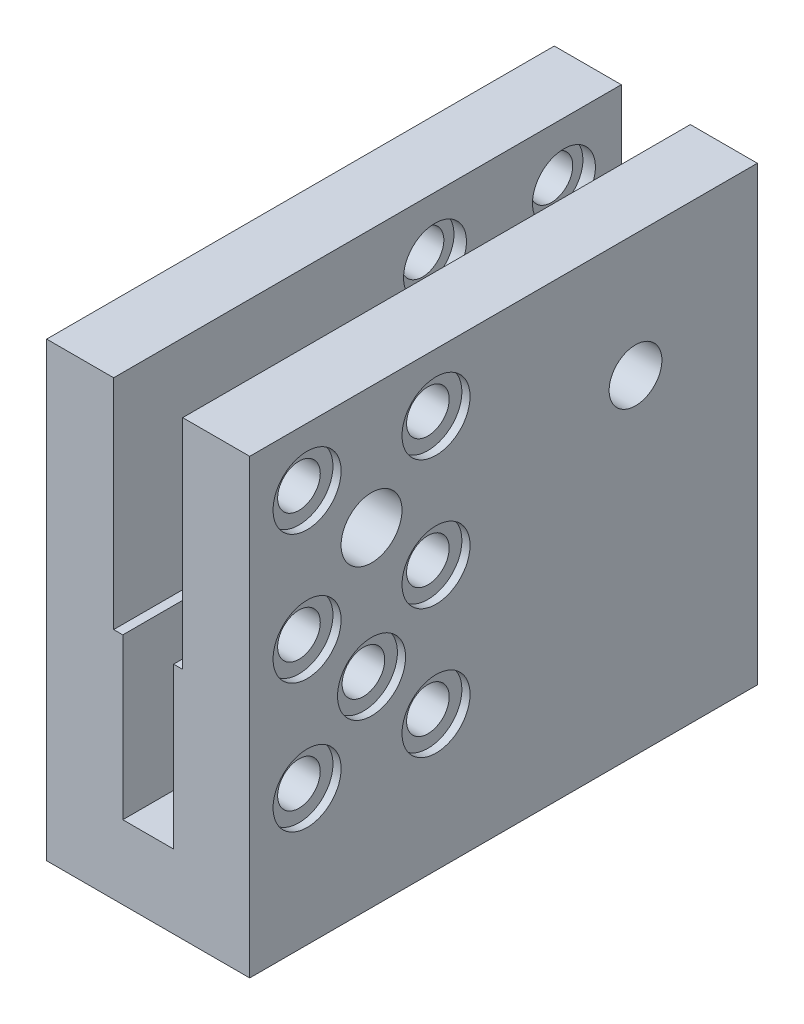
from build123d import *

# Parameters (mm, degrees)
SKETCH2_W           = 20
SKETCH2_H           = 50
BOSS_EXTRUDE1_DEPTH = 44.5
SKETCH3_W           = 6.8
SKETCH3_H           = 21.48
SKETCH3_W_2         = 5
SKETCH3_H_2         = 15.77
CUT_EXTRUDE3_DEPTH  = 68.677544282
SKETCH4_R           = 3
CUT_EXTRUDE4_DEPTH  = 55.820160525
SKETCH4_3_R         = 2.1
CUT_EXTRUDE5_DEPTH  = 6.6
BOSS_EXTRUDE2_START = -6.6
SKETCH5_R           = 3
SKETCH5_R_2         = 2.6
BOSS_EXTRUDE2_DEPTH = 6.6
SKETCH6_R           = 3.1
CUT_EXTRUDE6_DEPTH  = 1.23
SKETCH8_R           = 3.35
CUT_EXTRUDE8_DEPTH  = 0.8
CIRPATTERN1_COUNT   = 2
CIRPATTERN1_ANGLE   = 180
SKETCH12_R          = 2.35
CUT_EXTRUDE9_DEPTH  = 6.6


with BuildPart() as part:
    # Sketch2 → Boss-Extrude1 (new body)
    with BuildSketch(Plane(origin=(0, 0, 0), x_dir=(1, 0, 0), z_dir=(0, 1, 0))):
        Rectangle(SKETCH2_W, SKETCH2_H)
    extrude(amount=BOSS_EXTRUDE1_DEPTH)

    # Sketch3 → Cut-Extrude3 (cut, through all)
    with BuildSketch(Plane.XY.offset(25)):
        with Locations((0, 33.76)):
            Rectangle(SKETCH3_W, SKETCH3_H)
        with Locations((0, 15.135)):
            Rectangle(SKETCH3_W_2, SKETCH3_H_2)
    extrude(amount=-CUT_EXTRUDE3_DEPTH, mode=Mode.SUBTRACT)

    # Sketch4 → Cut-Extrude4 (cut, through all)
    with BuildSketch(Plane(origin=(10, 0, 0), x_dir=(0, 0, -1), z_dir=(1, 0, 0))):
        with Locations((-13, 32.41)):
            Circle(SKETCH4_R)
    cut_extrude4 = extrude(amount=-CUT_EXTRUDE4_DEPTH, mode=Mode.SUBTRACT)

    # Sketch4<3> → Cut-Extrude5 (cut)
    with BuildSketch(Plane(origin=(10, 0, 0), x_dir=(0, 0, -1), z_dir=(1, 0, 0))):
        with Locations((-13, 19.71)):
            Circle(SKETCH4_3_R)
        with Locations((-6.65, 38.76)):
            Circle(SKETCH4_3_R)
        with Locations((-6.65, 26.06)):
            Circle(SKETCH4_3_R)
        with Locations((-6.65, 13.36)):
            Circle(SKETCH4_3_R)
        with Locations((-19.35, 13.36)):
            Circle(SKETCH4_3_R)
        with Locations((-19.35, 26.06)):
            Circle(SKETCH4_3_R)
        with Locations((-19.35, 38.76)):
            Circle(SKETCH4_3_R)
    cut_extrude5 = extrude(amount=-CUT_EXTRUDE5_DEPTH, mode=Mode.SUBTRACT)

    # Sketch5 → Boss-Extrude2 (add)
    with BuildSketch(Plane.ZY.offset(10).offset(BOSS_EXTRUDE2_START)):
        with Locations((13, 32.41)):
            Circle(SKETCH5_R)
        with Locations((13, 32.41)):
            Circle(SKETCH5_R_2, mode=Mode.SUBTRACT)
    boss_extrude2 = extrude(amount=BOSS_EXTRUDE2_DEPTH)

    # Sketch6 → Cut-Extrude6 (cut)
    with BuildSketch(Plane.ZY.offset(-3.4)):
        with Locations((6.65, 13.36)):
            Circle(SKETCH6_R)
        with Locations((6.65, 26.06)):
            Circle(SKETCH6_R)
        with Locations((13, 19.71)):
            Circle(SKETCH6_R)
        with Locations((19.35, 13.36)):
            Circle(SKETCH6_R)
        with Locations((19.35, 26.06)):
            Circle(SKETCH6_R)
        with Locations((19.35, 38.76)):
            Circle(SKETCH6_R)
        with Locations((6.65, 38.76)):
            Circle(SKETCH6_R)
    cut_extrude6 = extrude(amount=-CUT_EXTRUDE6_DEPTH, mode=Mode.SUBTRACT)

    # Sketch8 → Cut-Extrude8 (cut)
    with BuildSketch(Plane(origin=(10, 0, 0), x_dir=(0, 0, -1), z_dir=(1, 0, 0))):
        with Locations((-6.65, 38.76)):
            Circle(SKETCH8_R)
        with Locations((-6.65, 26.06)):
            Circle(SKETCH8_R)
        with Locations((-6.65, 13.36)):
            Circle(SKETCH8_R)
        with Locations((-13, 19.71)):
            Circle(SKETCH8_R)
        with Locations((-19.35, 38.76)):
            Circle(SKETCH8_R)
        with Locations((-19.35, 26.06)):
            Circle(SKETCH8_R)
        with Locations((-19.35, 13.36)):
            Circle(SKETCH8_R)
    cut_extrude8 = extrude(amount=-CUT_EXTRUDE8_DEPTH, mode=Mode.SUBTRACT)

    # CirPattern1: Cut-Extrude4, Cut-Extrude5, Boss-Extrude2, Cut-Extrude6, Cut-Extrude8 ×2 about axis
    cirpattern1_axis = Axis((0, 44.5, 0), (0, -1, 0))
    add([cut_extrude4.rotate(cirpattern1_axis, i * CIRPATTERN1_ANGLE / (CIRPATTERN1_COUNT - 1)) for i in range(1, CIRPATTERN1_COUNT)], mode=Mode.SUBTRACT)
    add([cut_extrude5.rotate(cirpattern1_axis, i * CIRPATTERN1_ANGLE / (CIRPATTERN1_COUNT - 1)) for i in range(1, CIRPATTERN1_COUNT)], mode=Mode.SUBTRACT)
    add([boss_extrude2.rotate(cirpattern1_axis, i * CIRPATTERN1_ANGLE / (CIRPATTERN1_COUNT - 1)) for i in range(1, CIRPATTERN1_COUNT)])
    add([cut_extrude6.rotate(cirpattern1_axis, i * CIRPATTERN1_ANGLE / (CIRPATTERN1_COUNT - 1)) for i in range(1, CIRPATTERN1_COUNT)], mode=Mode.SUBTRACT)
    add([cut_extrude8.rotate(cirpattern1_axis, i * CIRPATTERN1_ANGLE / (CIRPATTERN1_COUNT - 1)) for i in range(1, CIRPATTERN1_COUNT)], mode=Mode.SUBTRACT)

    # Sketch12 → Cut-Extrude9 (cut)
    with BuildSketch(Plane(origin=(-10, 0, 0), x_dir=(0, 0, -1), z_dir=(1, 0, 0))):
        with Locations((-13, 6.59)):
            Circle(SKETCH12_R)
    extrude(amount=CUT_EXTRUDE9_DEPTH, mode=Mode.SUBTRACT)


solid = part.part
